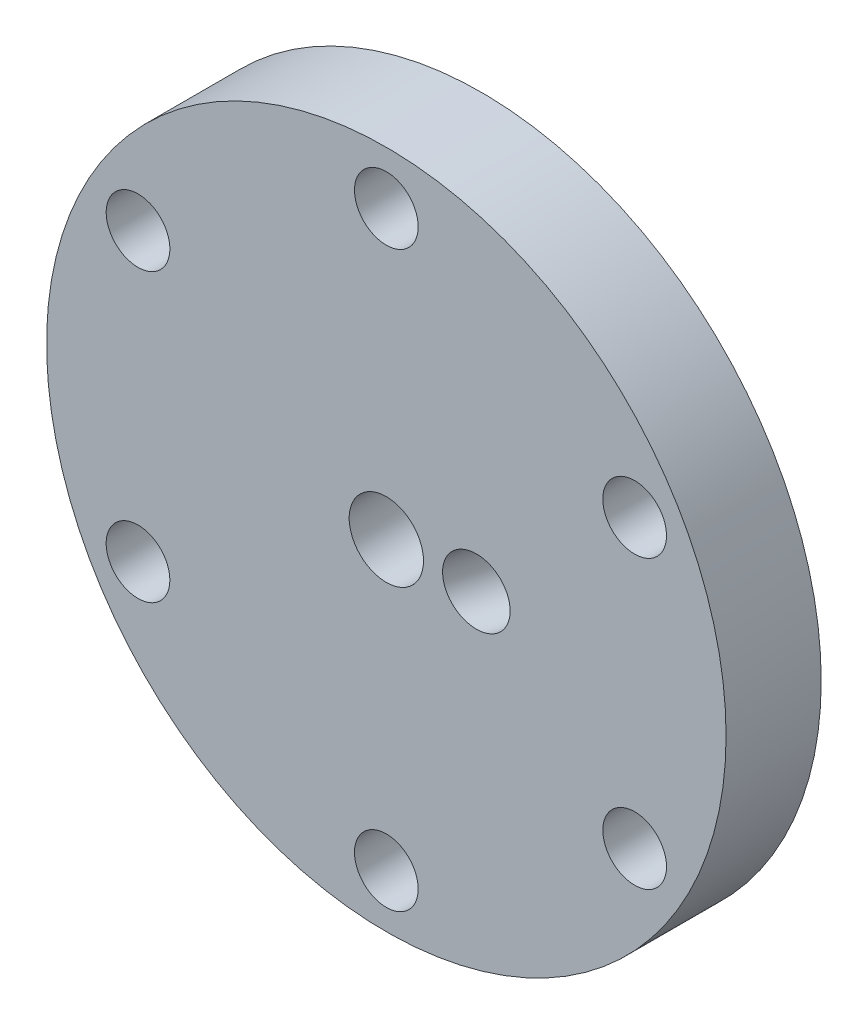
from build123d import *

# Parameters (mm, degrees)
SKETCH1_R           = 50.8
BOSS_EXTRUDE1_DEPTH = 7.112
SKETCH2_R           = 5.55625
CUT_EXTRUDE1_DEPTH  = 74.236617726
SKETCH3_R           = 4.7625
CUT_EXTRUDE2_DEPTH  = 74.236617726
CIRPATTERN1_COUNT   = 6
SKETCH5_R           = 4.8768
CUT_EXTRUDE3_DEPTH  = 25.4


with BuildPart() as part:
    # Sketch1 → Boss-Extrude1 (new, symmetric)
    with BuildSketch(Plane.XY):
        Circle(SKETCH1_R)
    extrude(amount=BOSS_EXTRUDE1_DEPTH, both=True)

    # Sketch2 → Cut-Extrude1 (cut, through all)
    with BuildSketch(Plane.XY.offset(7.112)):
        Circle(SKETCH2_R)
    extrude(amount=-CUT_EXTRUDE1_DEPTH, mode=Mode.SUBTRACT)

    # Sketch3 → Cut-Extrude2 (cut, through all)
    with BuildSketch(Plane.XY.offset(7.112)):
        with Locations((0, 42.8752)):
            Circle(SKETCH3_R)
    cut_extrude2 = extrude(amount=-CUT_EXTRUDE2_DEPTH, mode=Mode.SUBTRACT)

    # CirPattern1: Cut-Extrude2 ×6 about axis
    cirpattern1_axis = Axis((0, 0, -88.99), (0, 0, 1))
    for i in range(1, CIRPATTERN1_COUNT):
        add(cut_extrude2.rotate(cirpattern1_axis, i * 360 / CIRPATTERN1_COUNT), mode=Mode.SUBTRACT)

    # Sketch5 → Cut-Extrude3 (cut, symmetric)
    with BuildSketch(Plane(origin=(-0.876216993, 0, 3.270086336), x_dir=(0, -1, 0), z_dir=(-0.25881904510252135, 0, 0.9659258262890681))):
        with Locations((0, 14.844014522)):
            Circle(SKETCH5_R)
    extrude(amount=CUT_EXTRUDE3_DEPTH, both=True, mode=Mode.SUBTRACT)


solid = part.part
